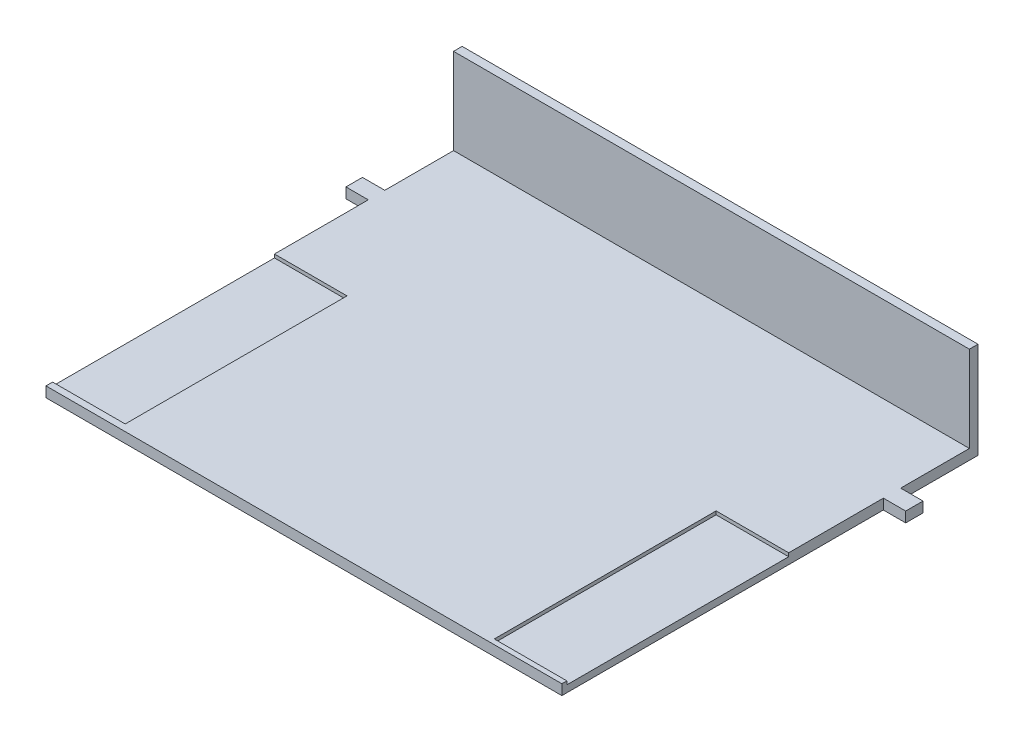
from build123d import *

# Parameters (mm, degrees)
SKETCH1_W           = 150
SKETCH1_H           = 3
BOSS_EXTRUDE1_DEPTH = 121
SKETCH3_W           = 21.1
SKETCH3_H           = 64.5
CUT_EXTRUDE1_DEPTH  = 1
SKETCH4_W           = 21.1
SKETCH4_H           = 64.5
CUT_EXTRUDE2_DEPTH  = 1
SKETCH6_W           = 6.5
SKETCH6_H           = 4.8
BOSS_EXTRUDE5_DEPTH = 3
SKETCH9_W           = 6.5
SKETCH9_H           = 5.03681905
BOSS_EXTRUDE7_DEPTH = 3
SKETCH10_W          = 150
SKETCH10_H          = 25
BOSS_EXTRUDE8_DEPTH = 2.5


with BuildPart() as part:
    # Sketch1 → Boss-Extrude1 (new body)
    with BuildSketch(Plane.XY):
        with Locations((75, 1.5)):
            Rectangle(SKETCH1_W, SKETCH1_H)
    extrude(amount=BOSS_EXTRUDE1_DEPTH)

    # Sketch3 → Cut-Extrude1 (cut)
    with BuildSketch(Plane(origin=(0, 3, 0), x_dir=(1, 0, 0), z_dir=(0, 1, 0))):
        with Locations((10.55, -86.824661278)):
            Rectangle(SKETCH3_W, SKETCH3_H)
    extrude(amount=-CUT_EXTRUDE1_DEPTH, mode=Mode.SUBTRACT)

    # Sketch4 → Cut-Extrude2 (cut)
    with BuildSketch(Plane(origin=(0, 3, 0), x_dir=(1, 0, 0), z_dir=(0, 1, 0))):
        with Locations((139.45, -87.298299378)):
            Rectangle(SKETCH4_W, SKETCH4_H)
    extrude(amount=-CUT_EXTRUDE2_DEPTH, mode=Mode.SUBTRACT)

    # Sketch6 → Boss-Extrude5 (add)
    with BuildSketch(Plane(origin=(0, 0, 0), x_dir=(1, 0, 0), z_dir=(0, 1, 0))):
        with Locations((-3.25, -24.887330639)):
            Rectangle(SKETCH6_W, SKETCH6_H)
    extrude(amount=BOSS_EXTRUDE5_DEPTH)

    # Sketch9 → Boss-Extrude7 (add)
    with BuildSketch(Plane(origin=(0, 3, 0), x_dir=(1, 0, 0), z_dir=(0, 1, 0))):
        with Locations((153.25, -25.005740164)):
            Rectangle(SKETCH9_W, SKETCH9_H)
    extrude(amount=-BOSS_EXTRUDE7_DEPTH)

    # Sketch10 → Boss-Extrude8 (add)
    with BuildSketch(Plane(origin=(0, 0, 0), x_dir=(-1, 0, 0), z_dir=(0, 0, -1))):
        with Locations((-75, 15.5)):
            Rectangle(SKETCH10_W, SKETCH10_H)
    extrude(amount=-BOSS_EXTRUDE8_DEPTH)


solid = part.part
